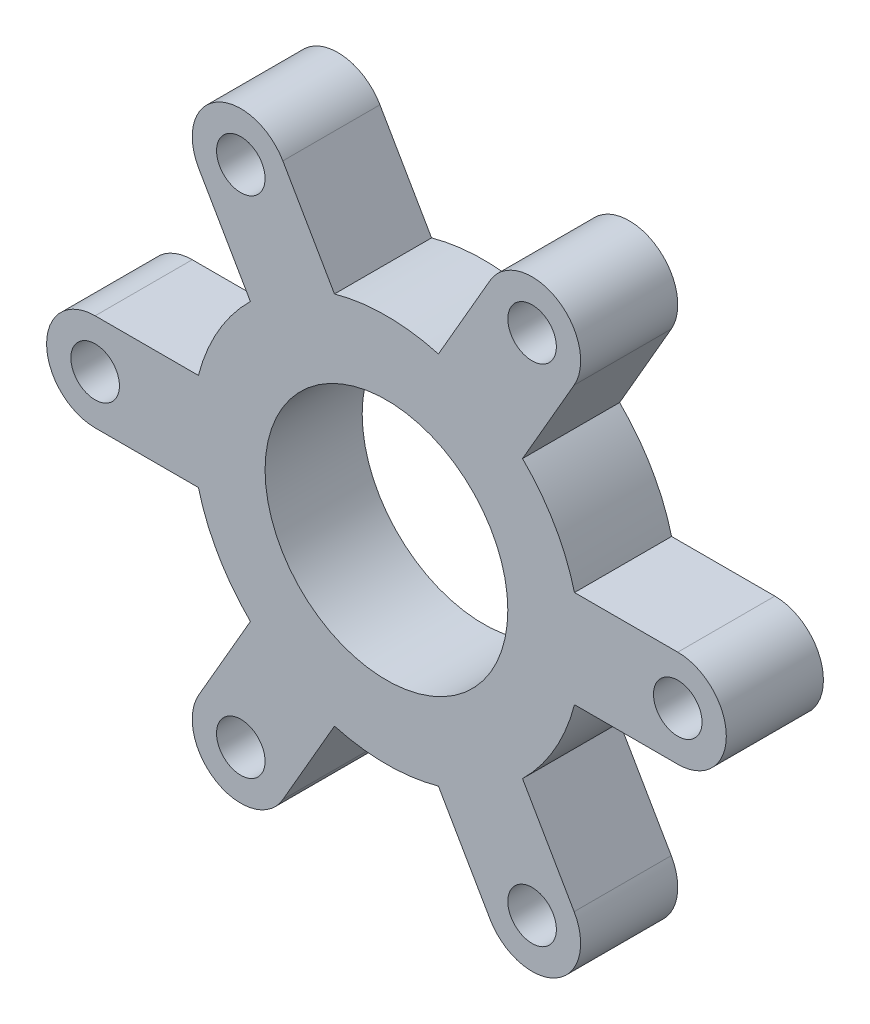
from build123d import *

# Parameters (mm, degrees)
SKETCH1_R           = 25
SKETCH1_R_2         = 5
BOSS_EXTRUDE1_DEPTH = 20


with BuildPart() as part:
    # Sketch1 → Boss-Extrude1 (new body)
    with BuildSketch(Plane.XY):
        with BuildLine():
            Line((-60, 10), (-38.729833462, 10))
            ThreePointArc((-38.729833462, 10), (-34.641016151, 20), (-28.025170769, 28.541019662))
            Line((-28.025170769, 28.541019662), (-38.660254038, 46.961524227))
            ThreePointArc((-38.660254038, 46.961524227), (-35, 60.621778265), (-21.339745962, 56.961524227))
            Line((-21.339745962, 56.961524227), (-10.704662693, 38.541019662))
            ThreePointArc((-10.704662693, 38.541019662), (0, 40), (10.704662693, 38.541019662))
            Line((10.704662693, 38.541019662), (21.339745962, 56.961524227))
            ThreePointArc((21.339745962, 56.961524227), (35, 60.621778265), (38.660254038, 46.961524227))
            Line((38.660254038, 46.961524227), (28.025170769, 28.541019662))
            ThreePointArc((28.025170769, 28.541019662), (34.641016151, 20), (38.729833462, 10))
            Line((38.729833462, 10), (60, 10))
            ThreePointArc((60, 10), (70, 0), (60, -10))
            Line((60, -10), (38.729833462, -10))
            ThreePointArc((38.729833462, -10), (34.641016151, -20), (28.025170769, -28.541019662))
            Line((28.025170769, -28.541019662), (38.660254038, -46.961524227))
            ThreePointArc((38.660254038, -46.961524227), (35, -60.621778265), (21.339745962, -56.961524227))
            Line((21.339745962, -56.961524227), (10.704662693, -38.541019662))
            ThreePointArc((10.704662693, -38.541019662), (0, -40), (-10.704662693, -38.541019662))
            Line((-10.704662693, -38.541019662), (-21.339745962, -56.961524227))
            ThreePointArc((-21.339745962, -56.961524227), (-35, -60.621778265), (-38.660254038, -46.961524227))
            Line((-38.660254038, -46.961524227), (-28.025170769, -28.541019662))
            ThreePointArc((-28.025170769, -28.541019662), (-34.641016151, -20), (-38.729833462, -10))
            Line((-38.729833462, -10), (-60, -10))
            ThreePointArc((-60, -10), (-70, 0), (-60, 10))
        make_face()
        Circle(SKETCH1_R, mode=Mode.SUBTRACT)
        with Locations((-60, 0)):
            Circle(SKETCH1_R_2, mode=Mode.SUBTRACT)
        with Locations((-30, 51.961524227)):
            Circle(SKETCH1_R_2, mode=Mode.SUBTRACT)
        with Locations((30, 51.961524227)):
            Circle(SKETCH1_R_2, mode=Mode.SUBTRACT)
        with Locations((60, 0)):
            Circle(SKETCH1_R_2, mode=Mode.SUBTRACT)
        with Locations((30, -51.961524227)):
            Circle(SKETCH1_R_2, mode=Mode.SUBTRACT)
        with Locations((-30, -51.961524227)):
            Circle(SKETCH1_R_2, mode=Mode.SUBTRACT)
    extrude(amount=BOSS_EXTRUDE1_DEPTH)


solid = part.part
